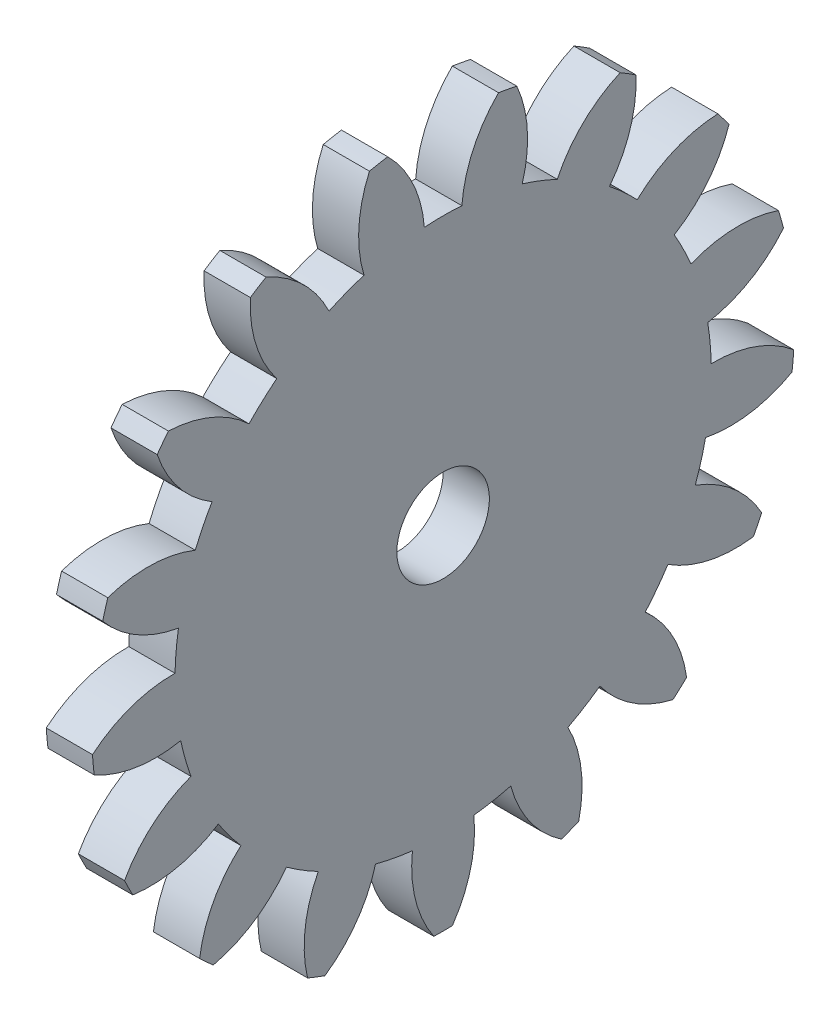
from build123d import *

# Parameters (mm, degrees)
BASPROSKE_W     = 5
BASPROSKE_H     = 38
TOOTHCUT_DEPTH  = 54.972215074
TEETHCUTS_COUNT = 17
TEETHCUTS_ANGLE = 338.823529412
BORSKE_R        = 5
BORE_DEPTH      = 50.0000508


with BuildPart() as part:
    # BasProSke → Base-Revolve (revolve)
    with BuildSketch(Plane(origin=(0, 0, 0), x_dir=(1, 0, 0), z_dir=(0, 1, 0)), mode=Mode.PRIVATE) as base_revolve_sk:
        with Locations((2.5, 19)):
            Rectangle(BASPROSKE_W, BASPROSKE_H)
    revolve(base_revolve_sk.sketch.rotate(Axis((-10, 0, 0), (1, 0, 0)), 180), axis=Axis((-10, 0, 0), (1, 0, 0)))

    # TooCutSke → ToothCut (cut, through all)
    with BuildSketch(Plane(origin=(0, 0, 0), x_dir=(0, 0, -1), z_dir=(1, 0, 0))):
        with BuildLine():
            ThreePointArc((2.030320852, 28.927837773), (0, 28.999), (-2.030320852, 28.927837773))
            ThreePointArc((-2.030320852, 28.927837773), (-3.246685552, 33.59632176), (-6.016319919, 37.546437112))
            ThreePointArc((-6.016319919, 37.546437112), (0, 38.0254), (6.016319919, 37.546437112))
            ThreePointArc((6.016319919, 37.546437112), (3.246685552, 33.59632176), (2.030320852, 28.927837773))
        make_face()
    toothcut = extrude(amount=TOOTHCUT_DEPTH, mode=Mode.SUBTRACT)

    # TeethCuts: ToothCut ×17 about axis
    teethcuts_axis = Axis((-10, 0, 0), (1, 0, 0))
    for i in range(1, TEETHCUTS_COUNT):
        add(toothcut.rotate(teethcuts_axis, i * TEETHCUTS_ANGLE / (TEETHCUTS_COUNT - 1)), mode=Mode.SUBTRACT)

    # BorSke → Bore (cut, symmetric)
    with BuildSketch(Plane(origin=(0, 0, 0), x_dir=(0, 0, -1), z_dir=(1, 0, 0))):
        with Locations(Location((0, 0, 0), (0, 0, 180))):
            Circle(BORSKE_R)
    extrude(amount=BORE_DEPTH, both=True, mode=Mode.SUBTRACT)


solid = part.part
